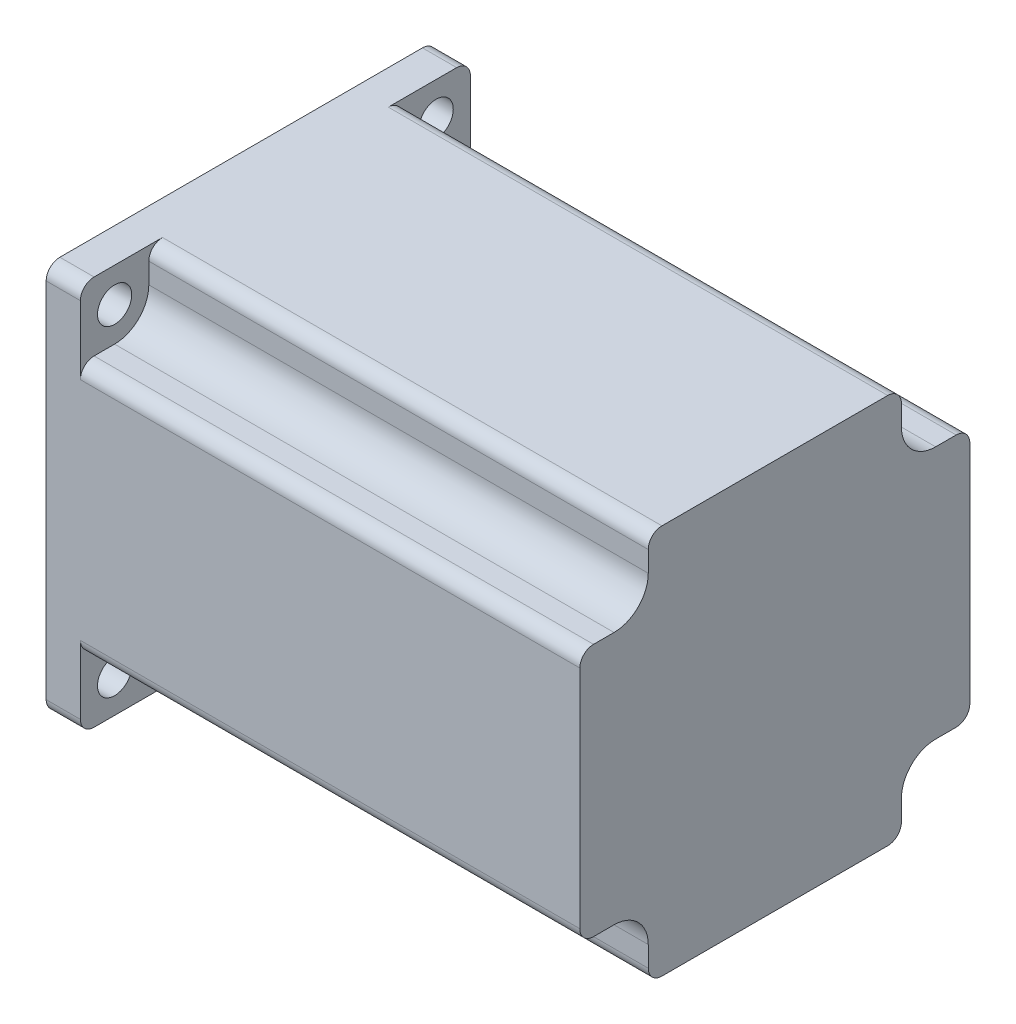
from build123d import *

# Parameters (mm, degrees)
SKETCH1_R            = 2.5
BOSS_EXTRUDE2_DEPTH  = 78
CUT_EXTRUDE1_START   = -73
CUT_EXTRUDE1_DEPTH   = 73
FILLET1_R            = 5
FILLET2_R            = 2
FILLET1_OF_MIRROR3_R = 5
FILLET3_R            = 2
SKETCH5_R            = 19.5
BOSS_EXTRUDE3_DEPTH  = 2
SKETCH6_R            = 4
BOSS_EXTRUDE4_DEPTH  = 20


with BuildPart() as part:
    # Sketch1 → Boss-Extrude2 (new body)
    with BuildSketch(Plane(origin=(0, 0, 0), x_dir=(0, 0, -1), z_dir=(1, 0, 0))):
        with BuildLine():
            Line((2, 0), (55, 0))
            ThreePointArc((55, 0), (56.414213562, -0.585786438), (57, -2))
            Line((57, -2), (57, -55))
            ThreePointArc((57, -55), (56.414213562, -56.414213562), (55, -57))
            Line((55, -57), (2, -57))
            ThreePointArc((2, -57), (0.585786438, -56.414213562), (0, -55))
            Line((0, -55), (0, -2))
            ThreePointArc((0, -2), (0.585786438, -0.585786438), (2, 0))
        make_face()
        with Locations((52, -5)):
            Circle(SKETCH1_R, mode=Mode.SUBTRACT)
        with Locations((52, -52)):
            Circle(SKETCH1_R, mode=Mode.SUBTRACT)
        with Locations(Location((5, -52, 0), (0, 0, 180))):
            Circle(SKETCH1_R, mode=Mode.SUBTRACT)
        with Locations(Location((5, -5, 0), (0, 0, 180))):
            Circle(SKETCH1_R, mode=Mode.SUBTRACT)
    extrude(amount=BOSS_EXTRUDE2_DEPTH)

    # Sketch4 → Cut-Extrude1 (cut)
    with BuildSketch(Plane(origin=(78, 0, 0), x_dir=(0, 0, -1), z_dir=(1, 0, 0)).offset(CUT_EXTRUDE1_START)):
        with BuildLine():
            Line((55, 0), (47, 0))
            Line((47, 0), (47, -10))
            Line((47, -10), (57, -10))
            Line((57, -10), (57, -2))
            ThreePointArc((57, -2), (56.414213562, -0.585786438), (55, 0))
        make_face()
        with BuildLine():
            Line((0, -2), (0, -10))
            Line((0, -10), (10, -10))
            Line((10, -10), (10, 0))
            Line((10, 0), (2, 0))
            ThreePointArc((2, 0), (0.585786438, -0.585786438), (0, -2))
        make_face()
    cut_extrude1 = extrude(amount=CUT_EXTRUDE1_DEPTH, mode=Mode.SUBTRACT)

    # Fillet1
    fillet1_edges = [part.edges().sort_by_distance(p)[0] for p in [
        (41.5, -10, -10),
        (41.5, -10, -47),
    ]]
    fillet(fillet1_edges, radius=FILLET1_R)

    # Fillet2
    fillet2_edges = [part.edges().sort_by_distance(p)[0] for p in [
        (41.5, 0, -10),
        (41.5, -10, 0),
        (41.5, -10, -57),
        (41.5, 0, -47),
    ]]
    fillet(fillet2_edges, radius=FILLET2_R)

    # Mirror3: Cut-Extrude1 across plane
    add(cut_extrude1.mirror(Plane.ZX.offset(-28.5)), mode=Mode.SUBTRACT)

    # Fillet1 of Mirror3
    fillet1_of_mirror3_edges = [part.edges().sort_by_distance(p)[0] for p in [
        (41.5, -47, -10),
        (41.5, -47, -47),
    ]]
    fillet(fillet1_of_mirror3_edges, radius=FILLET1_OF_MIRROR3_R)

    # Fillet3
    fillet3_edges = [part.edges().sort_by_distance(p)[0] for p in [
        (41.5, -47, 0),
        (41.5, -57, -10),
        (41.5, -57, -47),
        (41.5, -47, -57),
    ]]
    fillet(fillet3_edges, radius=FILLET3_R)

    # Sketch5 → Boss-Extrude3 (add)
    with BuildSketch(Plane.ZY):
        with Locations(Location((-28.5, -28.5, 0), (0, 0, 180))):
            Circle(SKETCH5_R)
    extrude(amount=BOSS_EXTRUDE3_DEPTH)

    # Sketch6 → Boss-Extrude4 (add)
    with BuildSketch(Plane.ZY.offset(2)):
        with Locations((-28.5, -28.5)):
            Circle(SKETCH6_R)
    extrude(amount=BOSS_EXTRUDE4_DEPTH)


solid = part.part
